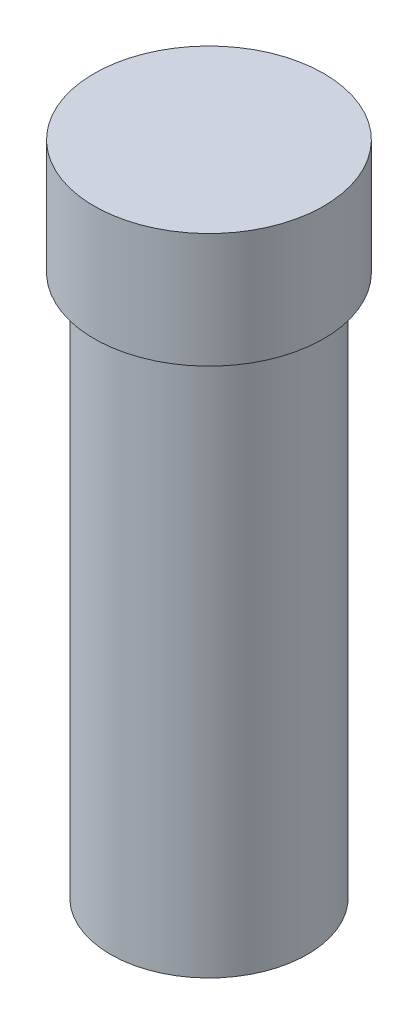
from build123d import *


with BuildPart() as part:
    # Sketch1 → Revolve1 (revolve)
    with BuildSketch(Plane.XY, mode=Mode.PRIVATE) as revolve1_sk:
        Polygon((0, 0), (0, 40), (7, 40), (7, 33), (6, 33), (6, 0), align=None)
    revolve(revolve1_sk.sketch.rotate(Axis((0, 0, 0), (0, 1, 0)), 90), axis=Axis((0, 0, 0), (0, 1, 0)))


solid = part.part
